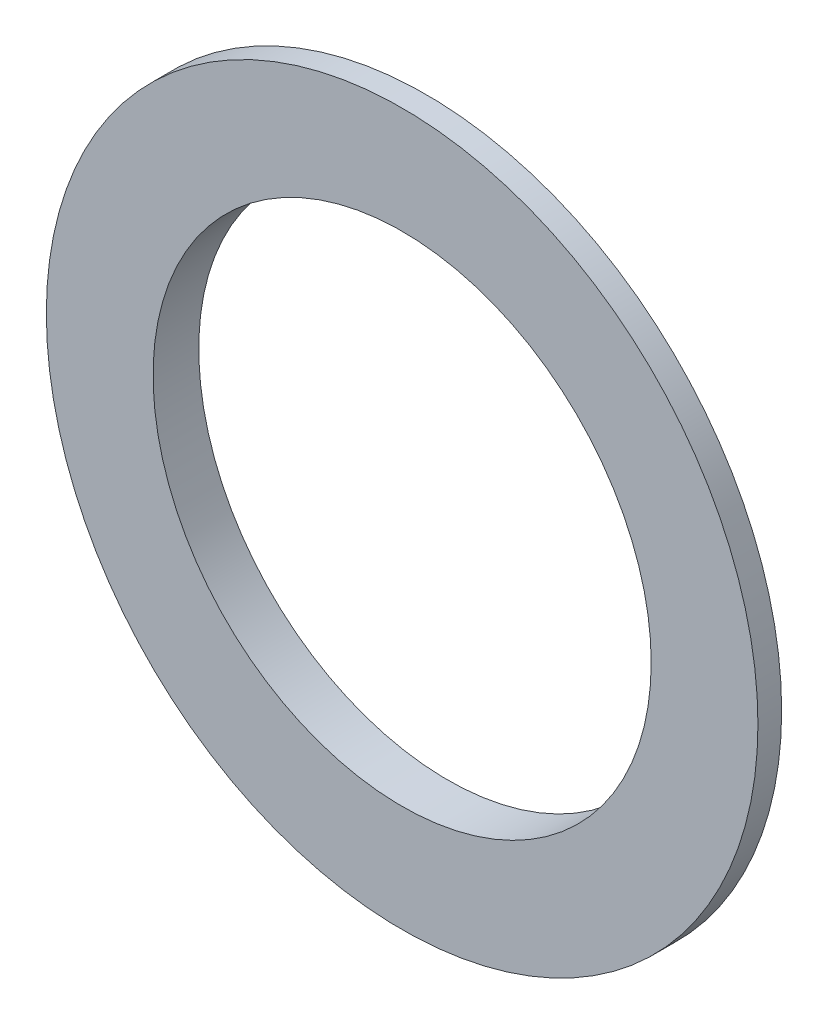
from build123d import *

# Parameters (mm, degrees)
ESBO_O2_R                = 22.35
ESBO_O2_R_2              = 21
RESSALTO_EXTRUS_O1_DEPTH = 1.85
ESBO_O3_R                = 30
ESBO_O3_R_2              = 21
RESSALTO_EXTRUS_O2_DEPTH = 2


with BuildPart() as part:
    # Esboço2 → Ressalto-extrusão1 (new body)
    with BuildSketch(Plane.XY):
        Circle(ESBO_O2_R)
        Circle(ESBO_O2_R_2, mode=Mode.SUBTRACT)
    extrude(amount=RESSALTO_EXTRUS_O1_DEPTH)

    # Esboço3 → Ressalto-extrusão2 (add)
    with BuildSketch(Plane.XY.offset(1.85)):
        Circle(ESBO_O3_R)
        Circle(ESBO_O3_R_2, mode=Mode.SUBTRACT)
    extrude(amount=RESSALTO_EXTRUS_O2_DEPTH)


solid = part.part
